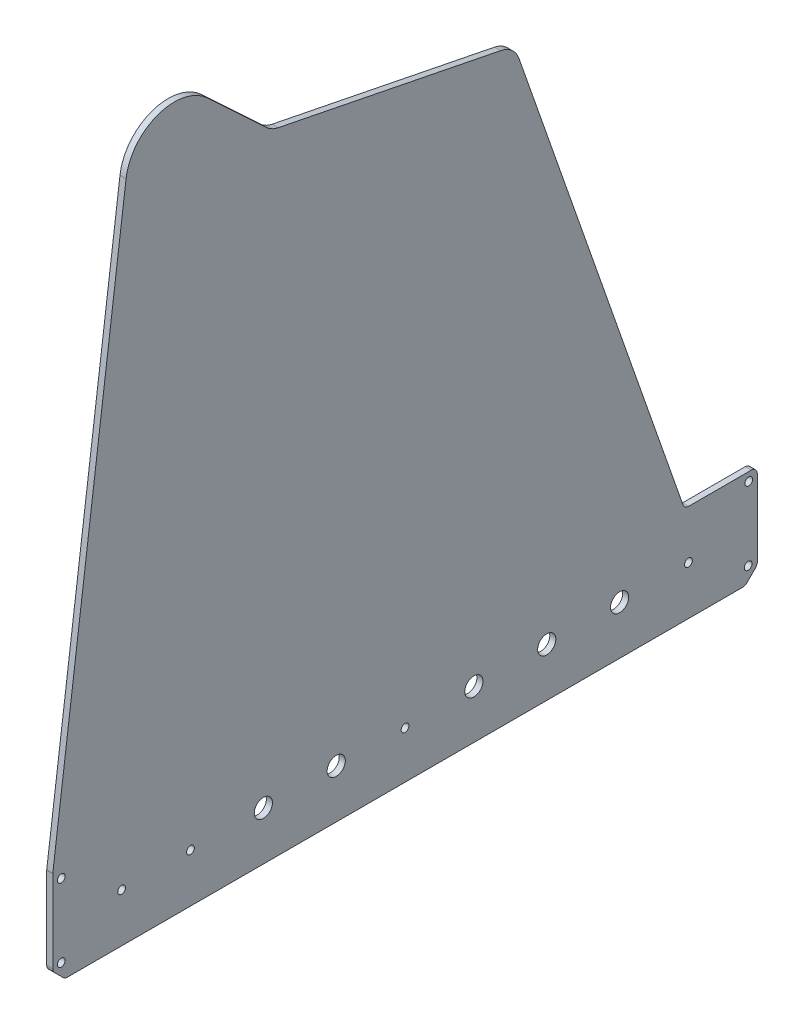
from build123d import *

# Parameters (mm, degrees)
BOSS_EXTRUDE1_DEPTH          = 3.175
CHAMFER1_SIZE                = 6.35
FILLET1_R                    = 12.7
F_3_8_0_375_DIAMETER_HOLE1_D = 9.525
F_8_CLEARANCE_HOLE1_D        = 4.064
FILLET2_R                    = 3.175
FILLET3_R                    = 3.175
F_8_CLEARANCE_HOLE2_D        = 4.064


with BuildPart() as part:
    # Sketch1 → Boss-Extrude1 (new body)
    with BuildSketch(Plane(origin=(0, 0, 0), x_dir=(0, 0, -1), z_dir=(1, 0, 0))):
        with BuildLine():
            Line((-184.15, -24.60625), (184.15, -24.60625))
            Line((184.15, -24.60625), (184.15, 26.19375))
            Line((184.15, 26.19375), (146.05, 26.19375))
            Line((146.05, 26.19375), (57.15, 280.19375))
            Line((57.15, 280.19375), (-69.85, 305.59375))
            Line((-69.85, 305.59375), (-103.309941035, 336.853985858))
            ThreePointArc((-103.309941035, 336.853985858), (-129.244818111, 342.195404789), (-145.838997174, 321.560923299))
            Line((-145.838997174, 321.560923299), (-184.15, 26.19375))
            Line((-184.15, 26.19375), (-184.15, -24.60625))
        make_face()
    extrude(amount=BOSS_EXTRUDE1_DEPTH)

    # Chamfer1
    chamfer1_edges = [part.edges().sort_by_distance(p)[0] for p in [
        (1.5875, -24.60625, -184.15),
        (1.5875, -24.60625, 184.15),
    ]]
    chamfer(chamfer1_edges, length=CHAMFER1_SIZE)

    # Fillet1
    fillet1_edges = [part.edges().sort_by_distance(p)[0] for p in [
        (1.5875, 305.59375, 69.85),
        (1.5875, 280.19375, -57.15),
    ]]
    fillet(fillet1_edges, radius=FILLET1_R)

    # 3/8 (0.375) Diameter Hole1 (through all)
    with Locations(Plane.ZY):
        with Locations((-112.174577673, 0.79375), (-74.074577673, 0.79375), (-35.974577673, 0.79375), (35.974577673, 0.79375), (74.074577673, 0.79375)):
            Hole(F_3_8_0_375_DIAMETER_HOLE1_D / 2)

    # #8 Clearance Hole1 (through all)
    with Locations(Plane.ZY):
        with Locations((148.157911006, 0.79375), (112.174577673, 0.79375), (-148.157911006, 0.79375), (0, 0)):
            Hole(F_8_CLEARANCE_HOLE1_D / 2)

    # Fillet2
    fillet2_edges = [part.edges().sort_by_distance(p)[0] for p in [
        (1.5875, 26.19375, 184.15),
        (1.5875, 26.19375, -146.05),
        (1.5875, 26.19375, -184.15),
    ]]
    fillet(fillet2_edges, radius=FILLET2_R)

    # Fillet3
    fillet3_edges = [part.edges().sort_by_distance(p)[0] for p in [
        (1.5875, -24.60625, -177.8),
        (1.5875, -24.60625, 177.8),
        (1.5875, -18.25625, 184.15),
        (1.5875, -18.25625, -184.15),
    ]]
    fillet(fillet3_edges, radius=FILLET3_R)

    # #8 Clearance Hole2 (through all)
    with Locations(Plane(origin=(3.175, 0, 0), x_dir=(0, 0, -1), z_dir=(1, 0, 0))):
        with Locations((-179.705, 21.74875), (-179.705, -16.415070715), (179.705, 21.74875), (179.3875, -16.283557909)):
            Hole(F_8_CLEARANCE_HOLE2_D / 2)


solid = part.part
